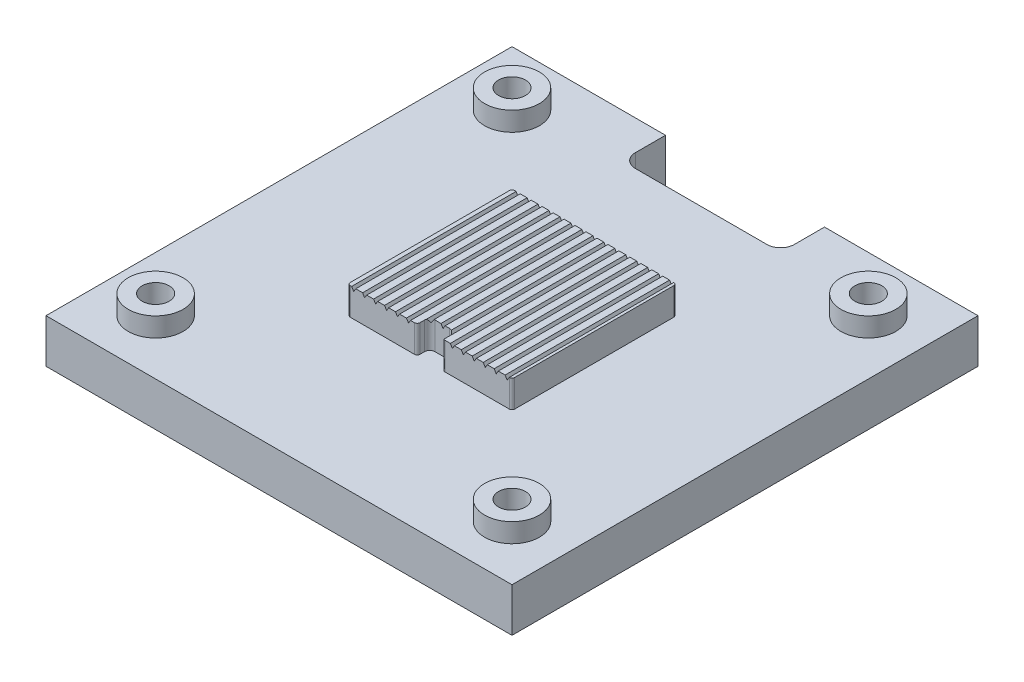
from build123d import *

# Parameters (mm, degrees)
SKETCH1_W           = 85
SKETCH1_H           = 85
SKETCH1_R           = 2.4575
BOSS_EXTRUDE1_DEPTH = 8
SKETCH2_R           = 3.969
CUT_EXTRUDE1_DEPTH  = 4.166
SKETCH3_R           = 5
SKETCH3_R_2         = 2.4575
BOSS_EXTRUDE2_DEPTH = 3.5
BOSS_EXTRUDE3_DEPTH = 5
SKETCH5_W           = 29
SKETCH5_H           = 8
CUT_EXTRUDE2_DEPTH  = 10
FILLET1_R           = 2.5
CUT_EXTRUDE3_REACH  = 74.674


with BuildPart() as part:
    # Sketch1 → Boss-Extrude1 (new body)
    with BuildSketch(Plane(origin=(0, 0, 0), x_dir=(1, 0, 0), z_dir=(0, 1, 0))):
        Rectangle(SKETCH1_W, SKETCH1_H)
        with Locations(Location((-32.5, 32.5, 0), (0, 0, 270))):
            Circle(SKETCH1_R, mode=Mode.SUBTRACT)
        with Locations(Location((-32.5, -32.5, 0), (0, 0, 90))):
            Circle(SKETCH1_R, mode=Mode.SUBTRACT)
        with Locations(Location((32.5, -32.5, 0), (0, 0, 270))):
            Circle(SKETCH1_R, mode=Mode.SUBTRACT)
        with Locations(Location((32.5, 32.5, 0), (0, 0, 90))):
            Circle(SKETCH1_R, mode=Mode.SUBTRACT)
    extrude(amount=BOSS_EXTRUDE1_DEPTH)

    # Sketch2 → Cut-Extrude1 (cut)
    with BuildSketch(Plane.XZ):
        with Locations(Location((-32.5, 32.5, 0), (0, 0, 270))):
            Circle(SKETCH2_R)
        with Locations(Location((32.5, 32.5, 0), (0, 0, 90))):
            Circle(SKETCH2_R)
        with Locations(Location((32.5, -32.5, 0), (0, 0, 270))):
            Circle(SKETCH2_R)
        with Locations(Location((-32.5, -32.5, 0), (0, 0, 90))):
            Circle(SKETCH2_R)
    extrude(amount=-CUT_EXTRUDE1_DEPTH, mode=Mode.SUBTRACT)

    # Sketch3 → Boss-Extrude2 (add)
    # profile 1 of 4: a face of its own
    with BuildSketch(Plane(origin=(0, 8, 0), x_dir=(1, 0, 0), z_dir=(0, 1, 0))):
        with Locations(Location((32.5, -32.5, 0), (0, 0, 270))):
            Circle(SKETCH3_R)
        with Locations(Location((32.5, -32.5, 0), (0, 0, 270))):
            Circle(SKETCH3_R_2, mode=Mode.SUBTRACT)
    # profile 2 of 4: a face of its own
    with BuildSketch(Plane(origin=(0, 8, 0), x_dir=(1, 0, 0), z_dir=(0, 1, 0))):
        with Locations(Location((-32.5, -32.5, 0), (0, 0, 90))):
            Circle(SKETCH3_R)
        with Locations(Location((-32.5, -32.5, 0), (0, 0, 90))):
            Circle(SKETCH3_R_2, mode=Mode.SUBTRACT)
    # profile 3 of 4: a face of its own
    with BuildSketch(Plane(origin=(0, 8, 0), x_dir=(1, 0, 0), z_dir=(0, 1, 0))):
        with Locations(Location((-32.5, 32.5, 0), (0, 0, 270))):
            Circle(SKETCH3_R)
        with Locations(Location((-32.5, 32.5, 0), (0, 0, 270))):
            Circle(SKETCH3_R_2, mode=Mode.SUBTRACT)
    # profile 4 of 4: a face of its own
    with BuildSketch(Plane(origin=(0, 8, 0), x_dir=(1, 0, 0), z_dir=(0, 1, 0))):
        with Locations(Location((32.5, 32.5, 0), (0, 0, 90))):
            Circle(SKETCH3_R)
        with Locations(Location((32.5, 32.5, 0), (0, 0, 90))):
            Circle(SKETCH3_R_2, mode=Mode.SUBTRACT)
    extrude(amount=BOSS_EXTRUDE2_DEPTH)

    # Sketch4 → Boss-Extrude3 (add)
    with BuildSketch(Plane(origin=(0, 8, 0), x_dir=(1, 0, 0), z_dir=(0, 1, 0))):
        with BuildLine():
            Line((2.2929, -14.5), (2.2929, -13.7071))
            ThreePointArc((2.2929, -13.7071), (2.000006781, -12.999993219), (1.2929, -12.7071))
            Line((1.2929, -12.7071), (-1.2929, -12.7071))
            ThreePointArc((-1.2929, -12.7071), (-2.000006781, -12.999993219), (-2.2929, -13.7071))
            Line((-2.2929, -13.7071), (-2.2929, -14.5))
            ThreePointArc((-2.2929, -14.5), (-2.439346609, -14.853553391), (-2.7929, -15))
            Line((-2.7929, -15), (-14.5, -15))
            ThreePointArc((-14.5, -15), (-14.853553391, -14.853553391), (-15, -14.5))
            Line((-15, -14.5), (-15, 14.5))
            ThreePointArc((-15, 14.5), (-14.853553391, 14.853553391), (-14.5, 15))
            Line((-14.5, 15), (14.5, 15))
            ThreePointArc((14.5, 15), (14.853553391, 14.853553391), (15, 14.5))
            Line((15, 14.5), (15, -14.5))
            ThreePointArc((15, -14.5), (14.853553391, -14.853553391), (14.5, -15))
            Line((14.5, -15), (2.7929, -15))
            ThreePointArc((2.7929, -15), (2.439346609, -14.853553391), (2.2929, -14.5))
        make_face()
    extrude(amount=BOSS_EXTRUDE3_DEPTH)

    # Sketch5 → Cut-Extrude2 (cut)
    with BuildSketch(Plane(origin=(0, 8, 0), x_dir=(1, 0, 0), z_dir=(0, 1, 0))):
        with Locations((0, 38.5)):
            Rectangle(SKETCH5_W, SKETCH5_H)
    extrude(amount=-CUT_EXTRUDE2_DEPTH, mode=Mode.SUBTRACT)

    # Fillet1
    fillet1_edges = [part.edges().sort_by_distance(p)[0] for p in [
        (-14.5, 4, -34.5),
        (14.5, 4, -34.5),
    ]]
    fillet(fillet1_edges, radius=FILLET1_R)

    # Sketch7 → Cut-Extrude3 (cut, up to next)
    with BuildSketch(Plane(origin=(0, 0, -15), x_dir=(-1, 0, 0), z_dir=(0, 0, -1)), mode=Mode.PRIVATE) as cut_extrude3_sk1:
        Polygon((-14.5, 13), (-14.125, 12.38), (-13.75, 13), align=None)
    cut_extrude3_tool1 = extrude(cut_extrude3_sk1.sketch, amount=-CUT_EXTRUDE3_REACH, mode=Mode.PRIVATE) & part.part
    # Sketch7 → Cut-Extrude3 (cut, up to next)
    with BuildSketch(Plane(origin=(0, 0, -15), x_dir=(-1, 0, 0), z_dir=(0, 0, -1)), mode=Mode.PRIVATE) as cut_extrude3_sk2:
        Polygon((-12.5, 13), (-12.125, 12.38), (-11.75, 13), align=None)
    cut_extrude3_tool2 = extrude(cut_extrude3_sk2.sketch, amount=-CUT_EXTRUDE3_REACH, mode=Mode.PRIVATE) & part.part
    # Sketch7 → Cut-Extrude3 (cut, up to next)
    with BuildSketch(Plane(origin=(0, 0, -15), x_dir=(-1, 0, 0), z_dir=(0, 0, -1)), mode=Mode.PRIVATE) as cut_extrude3_sk3:
        Polygon((-10.5, 13), (-10.125, 12.38), (-9.75, 13), align=None)
    cut_extrude3_tool3 = extrude(cut_extrude3_sk3.sketch, amount=-CUT_EXTRUDE3_REACH, mode=Mode.PRIVATE) & part.part
    # Sketch7 → Cut-Extrude3 (cut, up to next)
    with BuildSketch(Plane(origin=(0, 0, -15), x_dir=(-1, 0, 0), z_dir=(0, 0, -1)), mode=Mode.PRIVATE) as cut_extrude3_sk4:
        Polygon((-8.5, 13), (-8.125, 12.38), (-7.75, 13), align=None)
    cut_extrude3_tool4 = extrude(cut_extrude3_sk4.sketch, amount=-CUT_EXTRUDE3_REACH, mode=Mode.PRIVATE) & part.part
    # Sketch7 → Cut-Extrude3 (cut, up to next)
    with BuildSketch(Plane(origin=(0, 0, -15), x_dir=(-1, 0, 0), z_dir=(0, 0, -1)), mode=Mode.PRIVATE) as cut_extrude3_sk5:
        Polygon((-6.5, 13), (-6.125, 12.38), (-5.75, 13), align=None)
    cut_extrude3_tool5 = extrude(cut_extrude3_sk5.sketch, amount=-CUT_EXTRUDE3_REACH, mode=Mode.PRIVATE) & part.part
    # Sketch7 → Cut-Extrude3 (cut, up to next)
    with BuildSketch(Plane(origin=(0, 0, -15), x_dir=(-1, 0, 0), z_dir=(0, 0, -1)), mode=Mode.PRIVATE) as cut_extrude3_sk6:
        Polygon((-4.5, 13), (-4.125, 12.38), (-3.75, 13), align=None)
    cut_extrude3_tool6 = extrude(cut_extrude3_sk6.sketch, amount=-CUT_EXTRUDE3_REACH, mode=Mode.PRIVATE) & part.part
    # Sketch7 → Cut-Extrude3 (cut, up to next)
    with BuildSketch(Plane(origin=(0, 0, -15), x_dir=(-1, 0, 0), z_dir=(0, 0, -1)), mode=Mode.PRIVATE) as cut_extrude3_sk7:
        Polygon((-2.5, 13), (-2.125, 12.38), (-1.75, 13), align=None)
    cut_extrude3_tool7 = extrude(cut_extrude3_sk7.sketch, amount=-CUT_EXTRUDE3_REACH, mode=Mode.PRIVATE) & part.part
    # Sketch7 → Cut-Extrude3 (cut, up to next)
    with BuildSketch(Plane(origin=(0, 0, -15), x_dir=(-1, 0, 0), z_dir=(0, 0, -1)), mode=Mode.PRIVATE) as cut_extrude3_sk8:
        Polygon((-0.5, 13), (-0.125, 12.38), (0.25, 13), align=None)
    cut_extrude3_tool8 = extrude(cut_extrude3_sk8.sketch, amount=-CUT_EXTRUDE3_REACH, mode=Mode.PRIVATE) & part.part
    # Sketch7 → Cut-Extrude3 (cut, up to next)
    with BuildSketch(Plane(origin=(0, 0, -15), x_dir=(-1, 0, 0), z_dir=(0, 0, -1)), mode=Mode.PRIVATE) as cut_extrude3_sk9:
        Polygon((1.5, 13), (1.875, 12.38), (2.25, 13), align=None)
    cut_extrude3_tool9 = extrude(cut_extrude3_sk9.sketch, amount=-CUT_EXTRUDE3_REACH, mode=Mode.PRIVATE) & part.part
    # Sketch7 → Cut-Extrude3 (cut, up to next)
    with BuildSketch(Plane(origin=(0, 0, -15), x_dir=(-1, 0, 0), z_dir=(0, 0, -1)), mode=Mode.PRIVATE) as cut_extrude3_sk10:
        Polygon((3.5, 13), (3.875, 12.38), (4.25, 13), align=None)
    cut_extrude3_tool10 = extrude(cut_extrude3_sk10.sketch, amount=-CUT_EXTRUDE3_REACH, mode=Mode.PRIVATE) & part.part
    # Sketch7 → Cut-Extrude3 (cut, up to next)
    with BuildSketch(Plane(origin=(0, 0, -15), x_dir=(-1, 0, 0), z_dir=(0, 0, -1)), mode=Mode.PRIVATE) as cut_extrude3_sk11:
        Polygon((5.5, 13), (5.875, 12.38), (6.25, 13), align=None)
    cut_extrude3_tool11 = extrude(cut_extrude3_sk11.sketch, amount=-CUT_EXTRUDE3_REACH, mode=Mode.PRIVATE) & part.part
    # Sketch7 → Cut-Extrude3 (cut, up to next)
    with BuildSketch(Plane(origin=(0, 0, -15), x_dir=(-1, 0, 0), z_dir=(0, 0, -1)), mode=Mode.PRIVATE) as cut_extrude3_sk12:
        Polygon((7.5, 13), (7.875, 12.38), (8.25, 13), align=None)
    cut_extrude3_tool12 = extrude(cut_extrude3_sk12.sketch, amount=-CUT_EXTRUDE3_REACH, mode=Mode.PRIVATE) & part.part
    # Sketch7 → Cut-Extrude3 (cut, up to next)
    with BuildSketch(Plane(origin=(0, 0, -15), x_dir=(-1, 0, 0), z_dir=(0, 0, -1)), mode=Mode.PRIVATE) as cut_extrude3_sk13:
        Polygon((9.5, 13), (9.875, 12.38), (10.25, 13), align=None)
    cut_extrude3_tool13 = extrude(cut_extrude3_sk13.sketch, amount=-CUT_EXTRUDE3_REACH, mode=Mode.PRIVATE) & part.part
    # Sketch7 → Cut-Extrude3 (cut, up to next)
    with BuildSketch(Plane(origin=(0, 0, -15), x_dir=(-1, 0, 0), z_dir=(0, 0, -1)), mode=Mode.PRIVATE) as cut_extrude3_sk14:
        Polygon((11.5, 13), (11.875, 12.38), (12.25, 13), align=None)
    cut_extrude3_tool14 = extrude(cut_extrude3_sk14.sketch, amount=-CUT_EXTRUDE3_REACH, mode=Mode.PRIVATE) & part.part
    # Sketch7 → Cut-Extrude3 (cut, up to next)
    with BuildSketch(Plane(origin=(0, 0, -15), x_dir=(-1, 0, 0), z_dir=(0, 0, -1)), mode=Mode.PRIVATE) as cut_extrude3_sk15:
        Polygon((13.5, 13), (13.875, 12.38), (14.25, 13), align=None)
    cut_extrude3_tool15 = extrude(cut_extrude3_sk15.sketch, amount=-CUT_EXTRUDE3_REACH, mode=Mode.PRIVATE) & part.part
    add(cut_extrude3_tool1.solids().sort_by_distance((14.125, 12.793333, -15))[0], mode=Mode.SUBTRACT)
    add(cut_extrude3_tool2.solids().sort_by_distance((12.125, 12.793333, -15))[0], mode=Mode.SUBTRACT)
    add(cut_extrude3_tool3.solids().sort_by_distance((10.125, 12.793333, -15))[0], mode=Mode.SUBTRACT)
    add(cut_extrude3_tool4.solids().sort_by_distance((8.125, 12.793333, -15))[0], mode=Mode.SUBTRACT)
    add(cut_extrude3_tool5.solids().sort_by_distance((6.125, 12.793333, -15))[0], mode=Mode.SUBTRACT)
    add(cut_extrude3_tool6.solids().sort_by_distance((4.125, 12.793333, -15))[0], mode=Mode.SUBTRACT)
    add(cut_extrude3_tool7.solids().sort_by_distance((2.125, 12.793333, -15))[0], mode=Mode.SUBTRACT)
    add(cut_extrude3_tool8.solids().sort_by_distance((0.125, 12.793333, -15))[0], mode=Mode.SUBTRACT)
    add(cut_extrude3_tool9.solids().sort_by_distance((-1.875, 12.793333, -15))[0], mode=Mode.SUBTRACT)
    add(cut_extrude3_tool10.solids().sort_by_distance((-3.875, 12.793333, -15))[0], mode=Mode.SUBTRACT)
    add(cut_extrude3_tool11.solids().sort_by_distance((-5.875, 12.793333, -15))[0], mode=Mode.SUBTRACT)
    add(cut_extrude3_tool12.solids().sort_by_distance((-7.875, 12.793333, -15))[0], mode=Mode.SUBTRACT)
    add(cut_extrude3_tool13.solids().sort_by_distance((-9.875, 12.793333, -15))[0], mode=Mode.SUBTRACT)
    add(cut_extrude3_tool14.solids().sort_by_distance((-11.875, 12.793333, -15))[0], mode=Mode.SUBTRACT)
    add(cut_extrude3_tool15.solids().sort_by_distance((-13.875, 12.793333, -15))[0], mode=Mode.SUBTRACT)


solid = part.part
